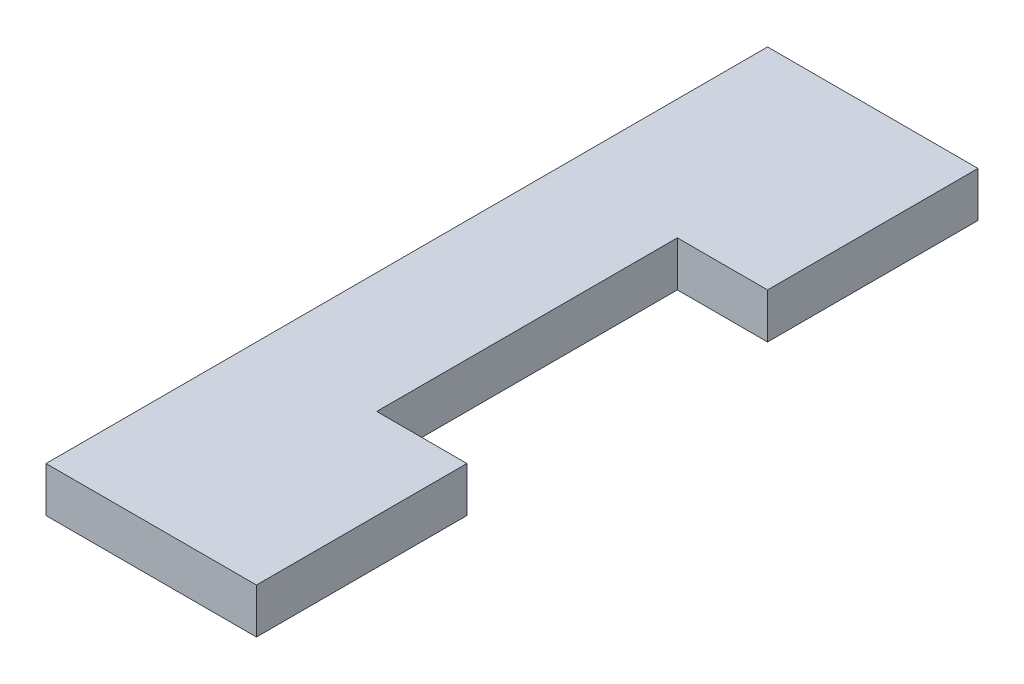
from build123d import *

# Parameters (mm, degrees)
BOSS_EXTRUDE1_DEPTH = 19.05


with BuildPart() as part:
    # Sketch1 → Boss-Extrude1 (new body)
    with BuildSketch(Plane(origin=(0, 0, 0), x_dir=(1, 0, 0), z_dir=(0, 1, 0))):
        Polygon((0, 0), (0, 304.8), (88.9, 304.8), (88.9, 215.9), (50.8, 215.9), (50.8, 88.9), (88.9, 88.9), (88.9, 0), align=None)
    extrude(amount=BOSS_EXTRUDE1_DEPTH)


solid = part.part
